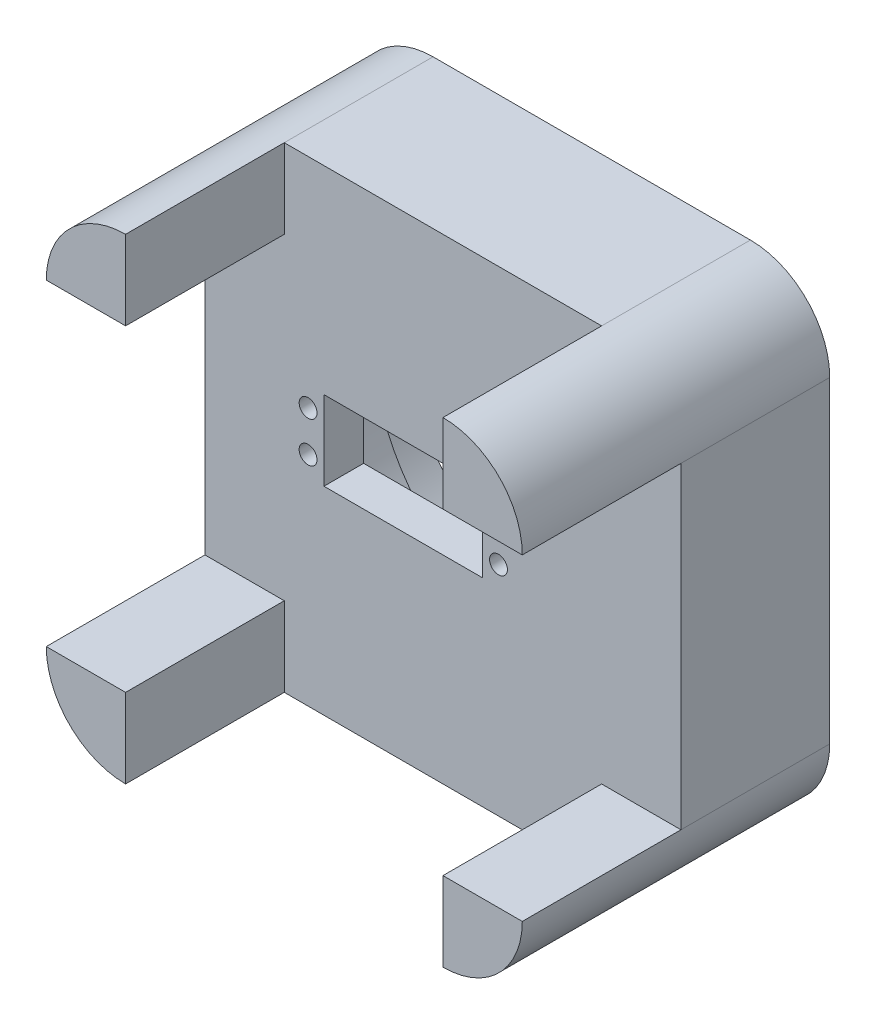
from build123d import *

# Parameters (mm, degrees)
SKETCH_1_W          = 120
SKETCH_1_H          = 120
EXTRUDE_1_DEPTH     = 100
SKETCH_2_R          = 47.5
CUT_EXTRUDE_1_DEPTH = 10
SKETCH_3_R          = 45
CUT_EXTRUDE_2_DEPTH = 17.5
SKETCH_4_W          = 120
SKETCH_4_H          = 120
CUT_EXTRUDE_3_DEPTH = 49.5
SKETCH_6_W          = 120
SKETCH_6_H          = 120
CUT_EXTRUDE_5_DEPTH = 13
CUT_EXTRUDE_6_DEPTH = 13
SKETCH_8_R          = 2.25
CUT_EXTRUDE_7_DEPTH = 13
SKETCH_10_R         = 2.25
CUT_EXTRUDE_8_DEPTH = 13
FILLET_1_R          = 20
FILLET_2_R          = 20
SKETCH_11_R         = 1.5
CUT_EXTRUDE_9_DEPTH = 10
EXTRUDE_START       = 40
EXTRUDE_3_DEPTH     = 40


with BuildPart() as part:
    # 草图1 → 凸台-拉伸1 (new body)
    with BuildSketch(Plane.XY):
        Rectangle(SKETCH_1_W, SKETCH_1_H)
    extrude(amount=EXTRUDE_1_DEPTH)

    # 草图2 → 切除-拉伸1 (cut)
    with BuildSketch(Plane(origin=(0, 0, 0), x_dir=(-1, 0, 0), z_dir=(0, 0, -1))):
        Circle(SKETCH_2_R)
    extrude(amount=-CUT_EXTRUDE_1_DEPTH, mode=Mode.SUBTRACT)

    # 草图3 → 切除-拉伸2 (cut)
    with BuildSketch(Plane(origin=(0, 0, 10), x_dir=(-1, 0, 0), z_dir=(0, 0, -1))):
        Circle(SKETCH_3_R)
    extrude(amount=-CUT_EXTRUDE_2_DEPTH, mode=Mode.SUBTRACT)

    # 草图4 → 切除-拉伸3 (cut)
    with BuildSketch(Plane.XY.offset(100)):
        Rectangle(SKETCH_4_W, SKETCH_4_H)
    extrude(amount=-CUT_EXTRUDE_3_DEPTH, mode=Mode.SUBTRACT)

    # 草图6 → 切除-拉伸5 (cut)
    with BuildSketch(Plane.XY.offset(50.5)):
        Rectangle(SKETCH_6_W, SKETCH_6_H)
    extrude(amount=-CUT_EXTRUDE_5_DEPTH, mode=Mode.SUBTRACT)

    # 草图7 → 切除-拉伸6 (cut)
    with BuildSketch(Plane(origin=(0, 0, 27.5), x_dir=(-1, 0, 0), z_dir=(0, 0, -1))):
        Polygon((-10, 10), (30, 10), (30, -10), (-10, -10), (-10, 0), align=None)
    extrude(amount=-CUT_EXTRUDE_6_DEPTH, mode=Mode.SUBTRACT)

    # 草图8 → 切除-拉伸7 (cut)
    with BuildSketch(Plane(origin=(0, 0, 27.5), x_dir=(-1, 0, 0), z_dir=(0, 0, -1))):
        with Locations((-14, 5.1)):
            Circle(SKETCH_8_R)
        with Locations((-14, -5.1)):
            Circle(SKETCH_8_R)
    extrude(amount=-CUT_EXTRUDE_7_DEPTH, mode=Mode.SUBTRACT)

    # 草图10 → 切除-拉伸8 (cut)
    with BuildSketch(Plane(origin=(0, 0, 27.5), x_dir=(-1, 0, 0), z_dir=(0, 0, -1))):
        with Locations((34, 5.1)):
            Circle(SKETCH_10_R)
        with Locations((34, -5.1)):
            Circle(SKETCH_10_R)
    extrude(amount=-CUT_EXTRUDE_8_DEPTH, mode=Mode.SUBTRACT)

    # 圆角1
    fillet_1_edges = [part.edges().sort_by_distance(p)[0] for p in [
        (60, 60, 18.75),
    ]]
    fillet(fillet_1_edges, radius=FILLET_1_R)

    # 圆角2
    fillet_2_edges = [part.edges().sort_by_distance(p)[0] for p in [
        (60, -60, 18.75),
        (-60, -60, 18.75),
        (-60, 60, 18.75),
    ]]
    fillet(fillet_2_edges, radius=FILLET_2_R)

    # 草图11 → 切除-拉伸9 (cut)
    with BuildSketch(Plane(origin=(0, 0, 0), x_dir=(-1, 0, 0), z_dir=(0, 0, -1))):
        with Locations((-38.890872965, 38.890872965)):
            Circle(SKETCH_11_R)
        with Locations((38.890872965, 38.890872965)):
            Circle(SKETCH_11_R)
        with Locations((38.890872965, -38.890872965)):
            Circle(SKETCH_11_R)
        with Locations((-38.890872965, -38.890872965)):
            Circle(SKETCH_11_R)
    extrude(amount=-CUT_EXTRUDE_9_DEPTH, mode=Mode.SUBTRACT)

    # 草图12 → 凸台-拉伸3 (add)
    with BuildSketch(Plane.XY.offset(37.5).offset(EXTRUDE_START)):
        with BuildLine():
            Line((-40, 40), (-40, 60))
            ThreePointArc((-40, 60), (-54.142135624, 54.142135624), (-60, 40))
            Line((-60, 40), (-40, 40))
        make_face()
        with BuildLine():
            Line((40, 40), (40, 60))
            ThreePointArc((40, 60), (54.142135624, 54.142135624), (60, 40))
            Line((60, 40), (40, 40))
        make_face()
        with BuildLine():
            Line((40, -40), (60, -40))
            ThreePointArc((60, -40), (54.142135624, -54.142135624), (40, -60))
            Line((40, -60), (40, -40))
        make_face()
        with BuildLine():
            Line((-40, -40), (-40, -60))
            ThreePointArc((-40, -60), (-54.142135624, -54.142135624), (-60, -40))
            Line((-60, -40), (-40, -40))
        make_face()
    extrude(amount=-EXTRUDE_3_DEPTH)


solid = part.part
